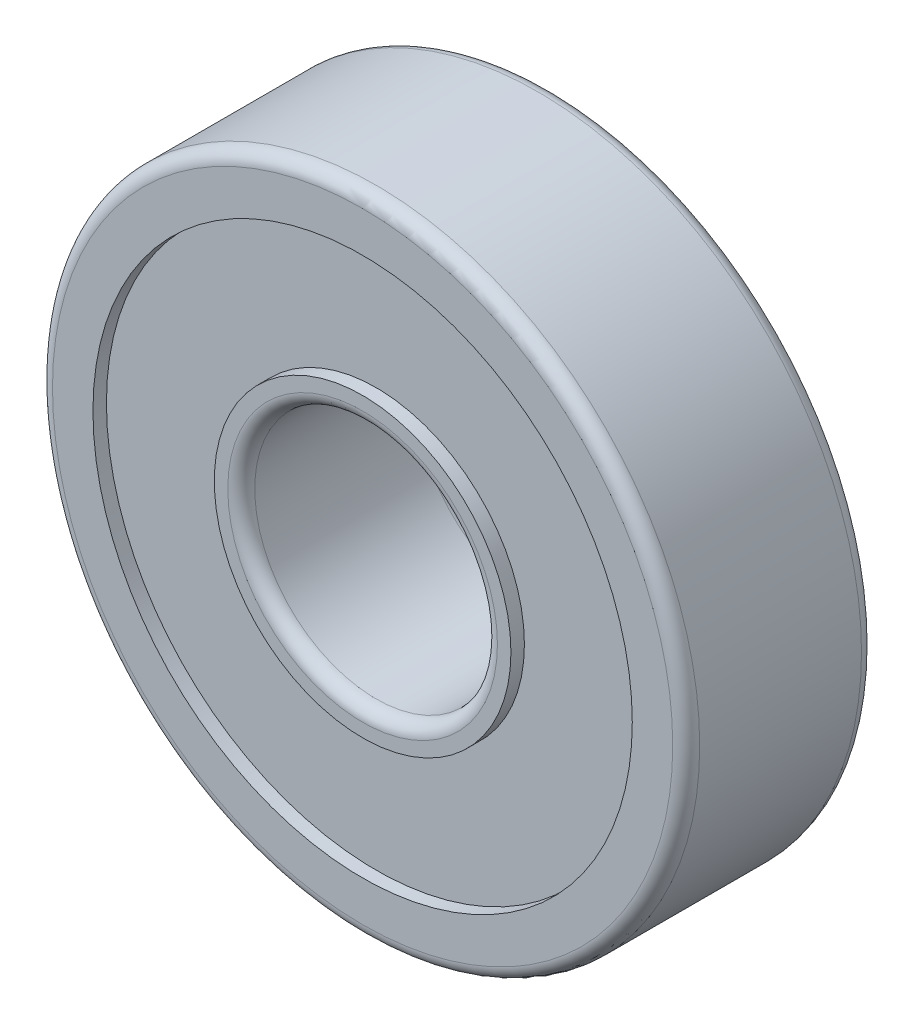
from build123d import *

# Parameters (mm, degrees)
SKETCH1_R           = 12
SKETCH1_R_2         = 4.5
BOSS_EXTRUDE1_DEPTH = 3.5
FILLET1_R           = 0.5
SKETCH2_R           = 10
SKETCH2_R_2         = 5.5
CUT_EXTRUDE1_DEPTH  = 0.5


with BuildPart() as part:
    # Sketch1 → Boss-Extrude1 (new, symmetric)
    with BuildSketch(Plane.XY):
        Circle(SKETCH1_R)
        Circle(SKETCH1_R_2, mode=Mode.SUBTRACT)
    extrude(amount=BOSS_EXTRUDE1_DEPTH, both=True)

    # Fillet1
    fillet1_edges = [part.edges().sort_by_distance(p)[0] for p in [
        (-12, 0, -3.5),
        (-12, 0, 3.5),
        (-4.5, 0, -3.5),
        (-4.5, 0, 3.5),
    ]]
    fillet(fillet1_edges, radius=FILLET1_R)

    # Sketch2 → Cut-Extrude1 (cut)
    with BuildSketch(Plane.XY.offset(3.5)):
        Circle(SKETCH2_R)
        Circle(SKETCH2_R_2, mode=Mode.SUBTRACT)
    cut_extrude1 = extrude(amount=-CUT_EXTRUDE1_DEPTH, mode=Mode.SUBTRACT)

    # Mirror1: Cut-Extrude1 across plane
    add(cut_extrude1.mirror(Plane.XY), mode=Mode.SUBTRACT)


solid = part.part
